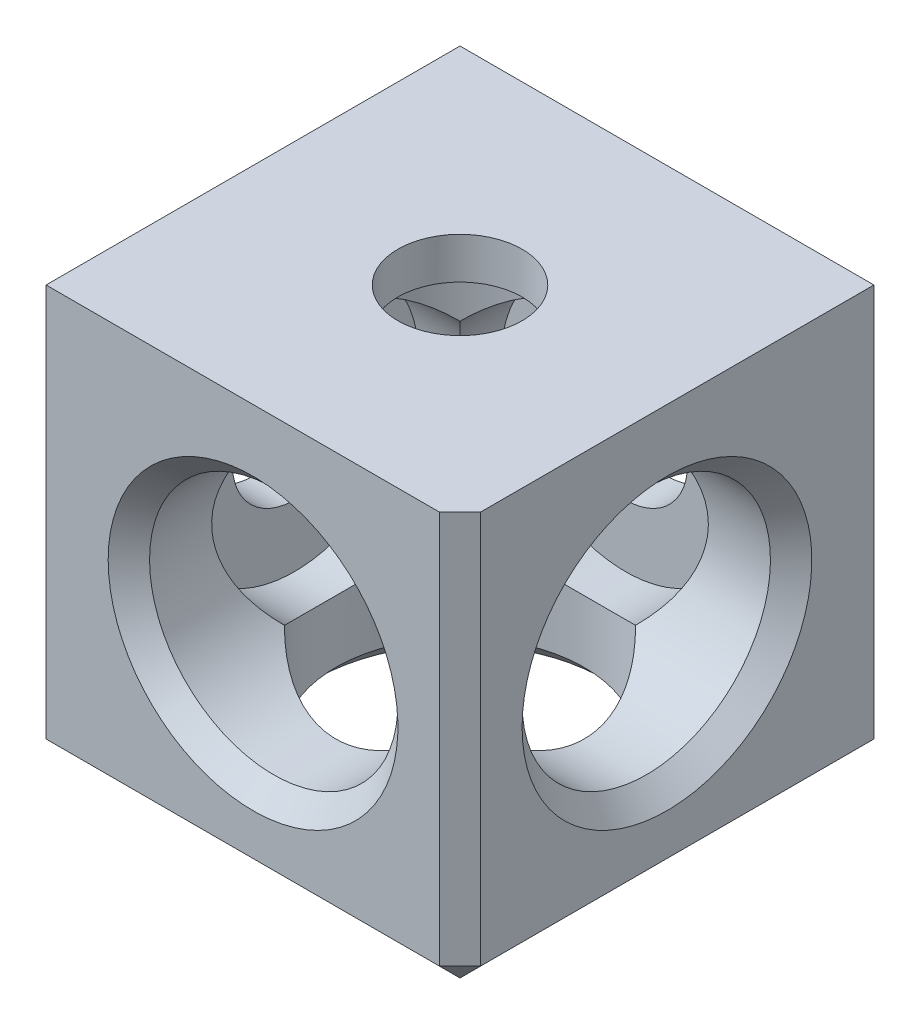
from build123d import *

# Parameters (mm, degrees)
SKETCH_1_W          = 20
SKETCH_1_H          = 20
EXTRUDE_1_DEPTH     = 20
SKETCH_2_R          = 3
CUT_EXTRUDE_1_DEPTH = 20
CUT_EXTRUDE_2_REACH = 32
SKETCH_3_R          = 3
CUT_EXTRUDE_3_REACH = 32
SKETCH_4_R          = 3
SKETCH_5_R          = 6
CUT_EXTRUDE_4_DEPTH = 18
SKETCH_6_R          = 6
CUT_EXTRUDE_5_DEPTH = 18
SKETCH_7_R          = 6
CUT_EXTRUDE_6_DEPTH = 18
CHAMFER_1_SIZE      = 1
CHAMFER_2_SIZE      = 1


with BuildPart() as part:
    # 草图1 → 凸台-拉伸1 (new body)
    with BuildSketch(Plane.XY):
        Rectangle(SKETCH_1_W, SKETCH_1_H)
    extrude(amount=EXTRUDE_1_DEPTH)

    # 草图2 → 切除-拉伸1 (cut)
    with BuildSketch(Plane(origin=(0, 0, 0), x_dir=(-1, 0, 0), z_dir=(0, 0, -1))):
        Circle(SKETCH_2_R)
    extrude(amount=-CUT_EXTRUDE_1_DEPTH, mode=Mode.SUBTRACT)

    # 切除-拉伸2: up to this face of the body (flat: up to its plane)
    cut_extrude_2_end = Plane(part.part.faces().sort_by_distance((-10, 0, 10))[0])
    # 草图3 → 切除-拉伸2 (cut, up to the picked face)
    with BuildSketch(Plane(origin=(10, 0, 0), x_dir=(0, 0, -1), z_dir=(1, 0, 0)), mode=Mode.PRIVATE) as cut_extrude_2_sk1:
        with Locations((-10, 0)):
            Circle(SKETCH_3_R)
    cut_extrude_2_tool1 = split(extrude(cut_extrude_2_sk1.sketch, amount=-CUT_EXTRUDE_2_REACH, mode=Mode.PRIVATE), bisect_by=cut_extrude_2_end, keep=Keep.BOTH, mode=Mode.PRIVATE)
    add(cut_extrude_2_tool1.solids().sort_by(Axis((10, 0, 10), (-1, 0, 0)))[0], mode=Mode.SUBTRACT)

    # 切除-拉伸3: up to this face of the body (flat: up to its plane)
    cut_extrude_3_end = Plane(part.part.faces().sort_by_distance((0, -10, 10))[0])
    # 草图4 → 切除-拉伸3 (cut, up to the picked face)
    with BuildSketch(Plane(origin=(0, 10, 0), x_dir=(1, 0, 0), z_dir=(0, 1, 0)), mode=Mode.PRIVATE) as cut_extrude_3_sk1:
        with Locations(Location((0, -10, 0), (0, 0, 270))):
            Circle(SKETCH_4_R)
    cut_extrude_3_tool1 = split(extrude(cut_extrude_3_sk1.sketch, amount=-CUT_EXTRUDE_3_REACH, mode=Mode.PRIVATE), bisect_by=cut_extrude_3_end, keep=Keep.BOTH, mode=Mode.PRIVATE)
    add(cut_extrude_3_tool1.solids().sort_by(Axis((0, 10, 10), (0, -1, 0)))[0], mode=Mode.SUBTRACT)

    # 草图5 → 切除-拉伸4 (cut)
    with BuildSketch(Plane(origin=(10, 0, 0), x_dir=(0, 0, -1), z_dir=(1, 0, 0))):
        with Locations((-10, 0)):
            Circle(SKETCH_5_R)
    extrude(amount=-CUT_EXTRUDE_4_DEPTH, mode=Mode.SUBTRACT)

    # 草图6 → 切除-拉伸5 (cut)
    with BuildSketch(Plane.XY.offset(20)):
        Circle(SKETCH_6_R)
    extrude(amount=-CUT_EXTRUDE_5_DEPTH, mode=Mode.SUBTRACT)

    # 草图7 → 切除-拉伸6 (cut)
    with BuildSketch(Plane.XZ.offset(10)):
        with Locations(Location((0, 10, 0), (0, 0, 270))):
            Circle(SKETCH_7_R)
    extrude(amount=-CUT_EXTRUDE_6_DEPTH, mode=Mode.SUBTRACT)

    # 倒角1
    chamfer_1_edges = [part.edges().sort_by_distance(p)[0] for p in [
        (0, -10, 20),
        (10, 0, 20),
        (10, -10, 10),
    ]]
    chamfer(chamfer_1_edges, length=CHAMFER_1_SIZE)

    # 倒角2
    chamfer_2_edges = [part.edges().sort_by_distance(p)[0] for p in [
        (10, 0, 16),
        (-6, 0, 20),
        (0, -10, 16),
    ]]
    chamfer(chamfer_2_edges, length=CHAMFER_2_SIZE)


solid = part.part
